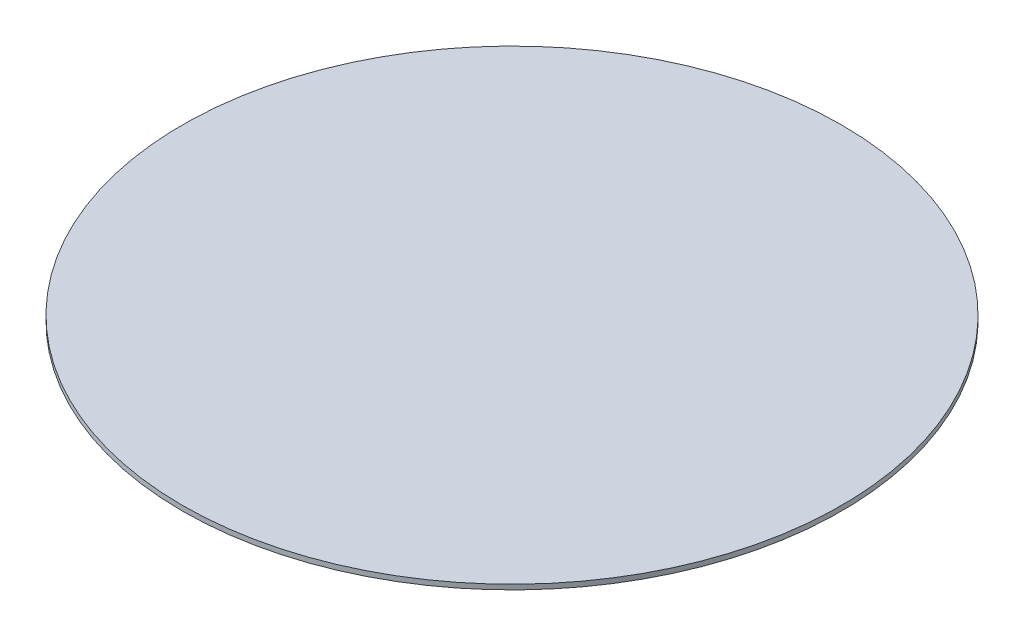
from build123d import *

# Parameters (mm, degrees)
SKETCH_1_R      = 200
EXTRUDE_1_DEPTH = 3


with BuildPart() as part:
    # Эскиз1 → Бобышка-Вытянуть1 (new body)
    with BuildSketch(Plane(origin=(0, 0, 0), x_dir=(1, 0, 0), z_dir=(0, 1, 0))):
        with Locations(Location((0, 0, 0), (0, 0, 270))):
            Circle(SKETCH_1_R)
    extrude(amount=EXTRUDE_1_DEPTH)


solid = part.part
